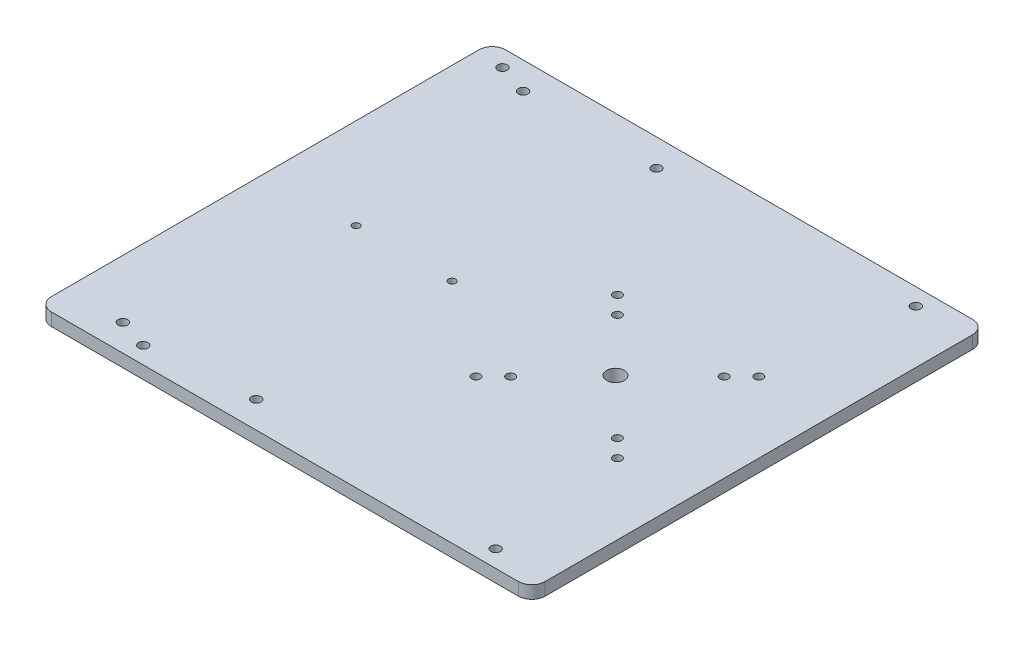
from build123d import *

# Parameters (mm, degrees)
BOSS_EXTRUDE1_DEPTH  = 4.7625
SKETCH4_R            = 1.778
JETSON_DEPTH         = 126.774558263
SKETCH3_R            = 1.35
VMU931_DEPTH         = 126.774558263
SKETCH6_R            = 1.59
LIDAR_URG_UST_DEPTH  = 126.774558263
SKETCH7_R            = 1.59
LIDAR_UTM_DEPTH      = 126.774558263
SKETCH9_R            = 3.3
LIDAR_VELODYNE_DEPTH = 126.774558263
SKETCH10_R           = 1.78
CUT_EXTRUDE5_DEPTH   = 126.774558263


with BuildPart() as part:
    # Sketch1 → Boss-Extrude1 (new body)
    with BuildSketch(Plane(origin=(0, 0, 0), x_dir=(1, 0, 0), z_dir=(0, 1, 0))):
        with BuildLine():
            Line((-87.5, 85.09), (87.5, 85.09))
            ThreePointArc((87.5, 85.09), (91.035533906, 83.625533906), (92.5, 80.09))
            Line((92.5, 80.09), (92.5, -80.09))
            ThreePointArc((92.5, -80.09), (91.035533906, -83.625533906), (87.5, -85.09))
            Line((87.5, -85.09), (-87.5, -85.09))
            ThreePointArc((-87.5, -85.09), (-91.035533906, -83.625533906), (-92.5, -80.09))
            Line((-92.5, -80.09), (-92.5, 80.09))
            ThreePointArc((-92.5, 80.09), (-91.035533906, 83.625533906), (-87.5, 85.09))
        make_face()
    extrude(amount=BOSS_EXTRUDE1_DEPTH)

    # Sketch4 → jetson (cut, through all)
    with BuildSketch(Plane(origin=(0, 0, 0), x_dir=(1, 0, 0), z_dir=(0, 1, 0))):
        with Locations(Location((-59.48, -78.74, 0), (0, 0, 90))):
            Circle(SKETCH4_R)
        with Locations(Location((-82.32, 78.74, 0), (0, 0, 90))):
            Circle(SKETCH4_R)
        with Locations(Location((72.6, 78.74, 0), (0, 0, 90))):
            Circle(SKETCH4_R)
        with Locations(Location((72.6, -78.74, 0), (0, 0, 90))):
            Circle(SKETCH4_R)
    extrude(amount=JETSON_DEPTH, mode=Mode.SUBTRACT)

    # Sketch3 → vmu931 (cut, through all)
    with BuildSketch(Plane(origin=(0, 0, 0), x_dir=(1, 0, 0), z_dir=(0, 1, 0))):
        with Locations(Location((-22.425235734, 0, 0), (0, 0, 90))):
            Circle(SKETCH3_R)
        with Locations(Location((-58.425235734, 0, 0), (0, 0, 90))):
            Circle(SKETCH3_R)
    extrude(amount=VMU931_DEPTH, mode=Mode.SUBTRACT)

    # Sketch6 → lidar urg/ust (cut, through all)
    with BuildSketch(Plane(origin=(0, 0, 0), x_dir=(1, 0, 0), z_dir=(0, 1, 0))):
        with Locations(Location((59.509273414, 20, 0), (0, 0, 90))):
            Circle(SKETCH6_R)
        with Locations(Location((59.509273414, -20, 0), (0, 0, 90))):
            Circle(SKETCH6_R)
        with Locations(Location((19.509273414, -20, 0), (0, 0, 90))):
            Circle(SKETCH6_R)
        with Locations(Location((19.509273414, 20, 0), (0, 0, 90))):
            Circle(SKETCH6_R)
    extrude(amount=LIDAR_URG_UST_DEPTH, mode=Mode.SUBTRACT)

    # Sketch7 → lidar utm (cut, through all)
    with BuildSketch(Plane(origin=(0, 0, 0), x_dir=(1, 0, 0), z_dir=(0, 1, 0))):
        with Locations(Location((13.009273414, 26.5, 0), (0, 0, 90))):
            Circle(SKETCH7_R)
        with Locations(Location((13.009273414, -26.5, 0), (0, 0, 90))):
            Circle(SKETCH7_R)
        with Locations(Location((66.009273414, -26.5, 0), (0, 0, 90))):
            Circle(SKETCH7_R)
        with Locations(Location((66.009273414, 26.5, 0), (0, 0, 90))):
            Circle(SKETCH7_R)
    extrude(amount=LIDAR_UTM_DEPTH, mode=Mode.SUBTRACT)

    # Sketch9 → lidar velodyne (cut, through all)
    with BuildSketch(Plane(origin=(0, 0, 0), x_dir=(1, 0, 0), z_dir=(0, 1, 0))):
        with Locations(Location((38.793326615, 0, 0), (0, 0, 90))):
            Circle(SKETCH9_R)
    extrude(amount=LIDAR_VELODYNE_DEPTH, mode=Mode.SUBTRACT)

    # Sketch10 → Cut-Extrude5 (cut, through all)
    with BuildSketch(Plane(origin=(0, 4.7625, 0), x_dir=(1, 0, 0), z_dir=(0, 1, 0))):
        with Locations(Location((-70.759751839, 74.91, 0), (0, 0, 270))):
            Circle(SKETCH10_R)
        with Locations(Location((-20.759751839, 74.91, 0), (0, 0, 270))):
            Circle(SKETCH10_R)
        with Locations(Location((-70.759751839, -75.09, 0), (0, 0, 270))):
            Circle(SKETCH10_R)
        with Locations(Location((-20.759751839, -75.09, 0), (0, 0, 270))):
            Circle(SKETCH10_R)
    extrude(amount=-CUT_EXTRUDE5_DEPTH, mode=Mode.SUBTRACT)


solid = part.part
